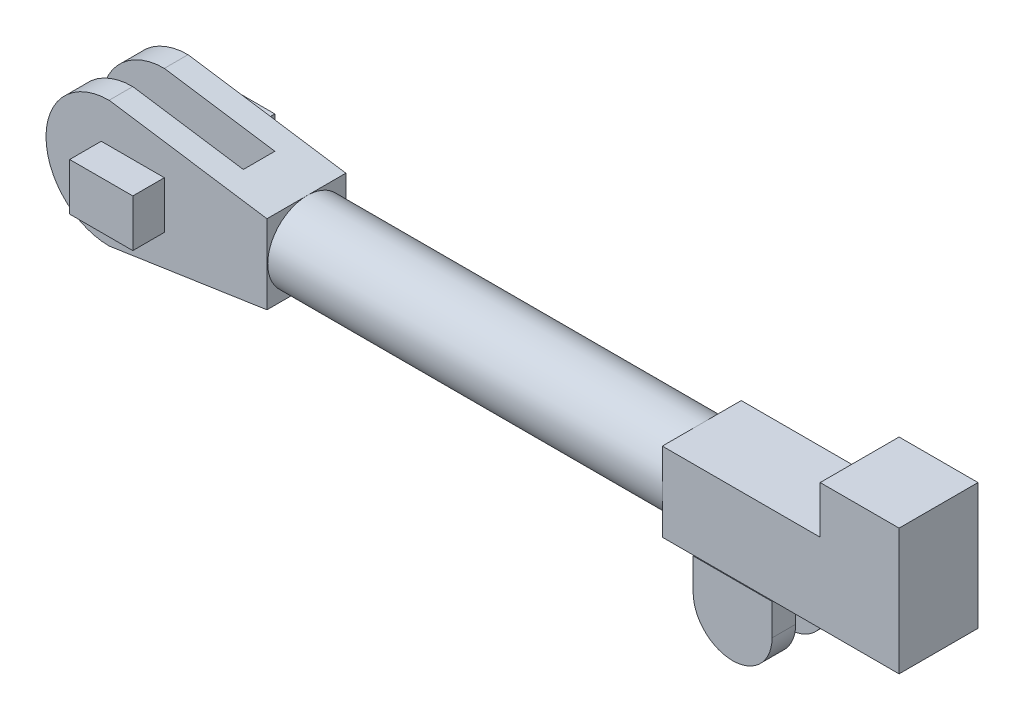
from build123d import *

# Parameters (mm, degrees)
BOSS_EXTRUDE2_DEPTH  = 127
SKETCH11_W           = 279.4
SKETCH11_H           = 50.8
CUT_EXTRUDE1_DEPTH   = 350.192267956
SKETCH12_R           = 63.5
BOSS_EXTRUDE3_DEPTH  = 635
SKETCH13_W           = 101.6
SKETCH13_H           = 76.2
BOSS_EXTRUDE4_DEPTH  = 50.8
SKETCH14_W           = 127
SKETCH14_H           = 127
BOSS_EXTRUDE6_DEPTH  = 254
SKETCH15_W           = 127
SKETCH15_H           = 203.2
BOSS_EXTRUDE7_DEPTH  = 127
SKETCH16_W           = 127
SKETCH16_H           = 50.8
BOSS_EXTRUDE9_DEPTH  = 63.5
BOSS_EXTRUDE10_DEPTH = 38.1
SKETCH21_R           = 12.7
BOSS_EXTRUDE11_DEPTH = 50.8
SKETCH22_R           = 12.7
BOSS_EXTRUDE12_DEPTH = 50.8
SKETCH24_W           = 50.922560847
SKETCH24_H           = 50.8
CUT_EXTRUDE2_DEPTH   = 271.018


with BuildPart() as part:
    # Sketch9 → Boss-Extrude2 (new body)
    with BuildSketch(Plane.XY):
        with BuildLine():
            Line((0, 101.6), (254, 63.5))
            Line((254, 63.5), (254, 0))
            Line((254, 0), (254, -63.5))
            Line((254, -63.5), (0, -101.6))
            ThreePointArc((0, -101.6), (-101.6, 0), (0, 101.6))
        make_face()
    extrude(amount=BOSS_EXTRUDE2_DEPTH)

    # Sketch11 → Cut-Extrude1 (cut, through all)
    with BuildSketch(Plane(origin=(0, 101.6, 0), x_dir=(1, 0, 0), z_dir=(0, 1, 0))):
        with Locations((38.1, -63.5)):
            Rectangle(SKETCH11_W, SKETCH11_H)
    extrude(amount=-CUT_EXTRUDE1_DEPTH, mode=Mode.SUBTRACT)

    # Sketch12 → Boss-Extrude3 (add)
    with BuildSketch(Plane(origin=(254, 0, 0), x_dir=(0, 0, -1), z_dir=(1, 0, 0))):
        with Locations(Location((-62.280099892, 0, 0), (0, 0, 90))):
            Circle(SKETCH12_R)
    extrude(amount=BOSS_EXTRUDE3_DEPTH)

    # Sketch13 → Boss-Extrude4 (add)
    with BuildSketch(Plane.XY.offset(127)):
        with Locations((38.1, 0)):
            Rectangle(SKETCH13_W, SKETCH13_H)
    boss_extrude4 = extrude(amount=BOSS_EXTRUDE4_DEPTH)

    # Mirror1: Boss-Extrude4 across plane
    add(boss_extrude4.mirror(Plane.XY.offset(63.5)))

    # Sketch14 → Boss-Extrude6 (add)
    with BuildSketch(Plane(origin=(889, 0, 0), x_dir=(0, 0, -1), z_dir=(1, 0, 0))):
        with Locations((-62.280099892, 0)):
            Rectangle(SKETCH14_W, SKETCH14_H)
    extrude(amount=BOSS_EXTRUDE6_DEPTH)

    # Sketch15 → Boss-Extrude7 (add)
    with BuildSketch(Plane(origin=(1143, 0, 0), x_dir=(0, 0, -1), z_dir=(1, 0, 0))):
        with Locations((-62.280099892, 38.1)):
            Rectangle(SKETCH15_W, SKETCH15_H)
    extrude(amount=BOSS_EXTRUDE7_DEPTH)

    # Sketch16 → Boss-Extrude9 (add)
    with BuildSketch(Plane.XY.offset(63.5)):
        with Locations((1003.3, -88.9)):
            Rectangle(SKETCH16_W, SKETCH16_H)
    boss_extrude9 = extrude(amount=BOSS_EXTRUDE9_DEPTH)

    # Sketch20 → Boss-Extrude10 (add)
    with BuildSketch(Plane.XY.offset(127)):
        with BuildLine():
            Line((939.8, -114.3), (1066.8, -114.3))
            ThreePointArc((1066.8, -114.3), (1003.3, -177.8), (939.8, -114.3))
        make_face()
    boss_extrude10 = extrude(amount=-BOSS_EXTRUDE10_DEPTH)

    # Mirror2: Boss-Extrude9, Boss-Extrude10 across plane
    add(boss_extrude9.mirror(Plane.XY.offset(63.5)))
    add(boss_extrude10.mirror(Plane.XY.offset(63.5)))

    # Sketch21 → Boss-Extrude11 (add)
    with BuildSketch(Plane.XY.offset(38.1)):
        with Locations(Location((0, 0, 0), (0, 0, 180))):
            Circle(SKETCH21_R)
    extrude(amount=BOSS_EXTRUDE11_DEPTH)

    # Sketch22 → Boss-Extrude12 (add)
    with BuildSketch(Plane.XY.offset(38.1)):
        with Locations(Location((1003.3, -139.7, 0), (0, 0, 180))):
            Circle(SKETCH22_R)
    extrude(amount=BOSS_EXTRUDE12_DEPTH)

    # Sketch24 → Cut-Extrude2 (cut)
    with BuildSketch(Plane(origin=(1066.8, 0, 0), x_dir=(0, 0, -1), z_dir=(1, 0, 0))):
        with Locations((-63.561280424, -88.9)):
            Rectangle(SKETCH24_W, SKETCH24_H)
    extrude(amount=-CUT_EXTRUDE2_DEPTH, mode=Mode.SUBTRACT)


solid = part.part
